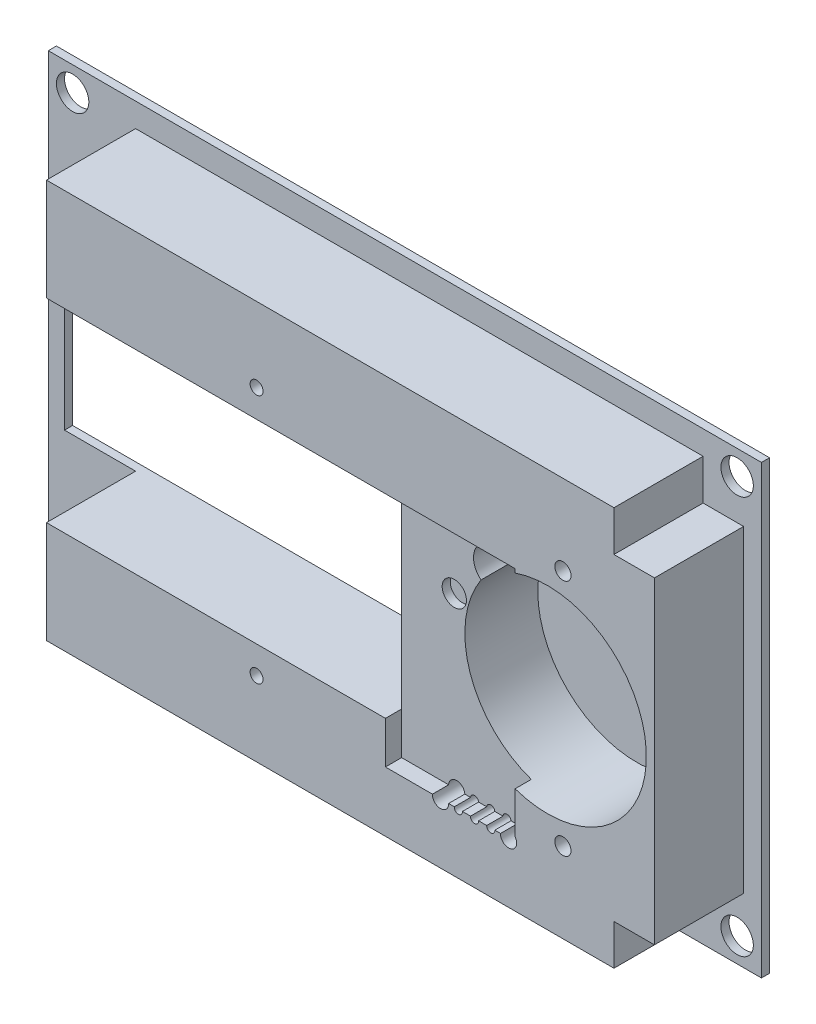
from build123d import *

# Parameters (mm, degrees)
SKETCH_1_W          = 75.027591161
SKETCH_1_H          = 49.216029974
EXTRUDE_1_DEPTH     = 11
CUT_EXTRUDE_START   = -11
SKETCH_2_R          = 1
SKETCH_2_R_2        = 1.5
SKETCH_2_R_3        = 0.8
CUT_EXTRUDE_1_DEPTH = 3
SKETCH_2_4_R        = 12.2
SKETCH_2_4_W        = 5
SKETCH_2_4_H        = 5
SKETCH_2_4_W_2      = 41.827591161
SKETCH_2_4_H_2      = 24
CUT_EXTRUDE_3_DEPTH = 80.722605558
SKETCH_4_W          = 88
SKETCH_4_H          = 55.1
SKETCH_4_R          = 2
SKETCH_4_W_2        = 50.6
SKETCH_4_H_2        = 24
EXTRUDE_2_DEPTH     = 1
SKETCH_5_R          = 2.5
CUT_EXTRUDE_4_DEPTH = 91.910079199
SKETCH_7_W          = 9.2
SKETCH_7_H          = 5
CUT_EXTRUDE_6_DEPTH = 2
SKETCH_8_R          = 1
SKETCH_8_R_2        = 0.5
CUT_EXTRUDE_7_DEPTH = 91.910079199
SKETCH_9_W          = 16
SKETCH_9_H          = 29.2
CUT_EXTRUDE_8_DEPTH = 2


with BuildPart() as part:
    # 草图1 → 凸台-拉伸1 (new body)
    with BuildSketch(Plane.XY):
        with Locations((-37.513795581, 0)):
            Rectangle(SKETCH_1_W, SKETCH_1_H)
    extrude(amount=EXTRUDE_1_DEPTH)

    # 草图2 → 切除-拉伸1 (cut)
    with BuildSketch(Plane(origin=(0, 0, 0), x_dir=(-1, 0, 0), z_dir=(0, 0, -1)).offset(CUT_EXTRUDE_START)):
        with Locations(Location((11.3, 14.7, 0), (0, 0, 180))):
            Circle(SKETCH_2_R)
        with Locations(Location((11.3, -14.7, 0), (0, 0, 180))):
            Circle(SKETCH_2_R)
        with Locations(Location((26.7, 3.6, 0), (0, 0, 180))):
            Circle(SKETCH_2_R_2)
        with Locations(Location((49.1, 15.4, 0), (0, 0, 180))):
            Circle(SKETCH_2_R_3)
        with Locations(Location((49.1, -15.4, 0), (0, 0, 180))):
            Circle(SKETCH_2_R_3)
    extrude(amount=CUT_EXTRUDE_1_DEPTH, mode=Mode.SUBTRACT)

    # 草图2<4> → 切除-拉伸3 (cut, through all)
    with BuildSketch(Plane(origin=(0, 0, 0), x_dir=(-1, 0, 0), z_dir=(0, 0, -1))):
        with Locations((13.2, 0)):
            Circle(SKETCH_2_4_R)
        with Locations((2.5, 22.108014987)):
            Rectangle(SKETCH_2_4_W, SKETCH_2_4_H)
        with Locations((2.5, -22.108014987)):
            Rectangle(SKETCH_2_4_W, SKETCH_2_4_H)
        with Locations((54.113795581, 0)):
            Rectangle(SKETCH_2_4_W_2, SKETCH_2_4_H_2)
    extrude(amount=-CUT_EXTRUDE_3_DEPTH, mode=Mode.SUBTRACT)

    # 草图4 → 凸台-拉伸2 (add)
    with BuildSketch(Plane(origin=(0, 0, 0), x_dir=(-1, 0, 0), z_dir=(0, 0, -1))):
        with Locations((41.8, 0)):
            Rectangle(SKETCH_4_W, SKETCH_4_H)
        with Locations((0.8, 24.55)):
            Circle(SKETCH_4_R, mode=Mode.SUBTRACT)
        with Locations((0.8, -24.55)):
            Circle(SKETCH_4_R, mode=Mode.SUBTRACT)
        with Locations((82.8, -24.55)):
            Circle(SKETCH_4_R, mode=Mode.SUBTRACT)
        with Locations((82.8, 24.55)):
            Circle(SKETCH_4_R, mode=Mode.SUBTRACT)
        with Locations((58.5, 0)):
            Rectangle(SKETCH_4_W_2, SKETCH_4_H_2, mode=Mode.SUBTRACT)
    extrude(amount=EXTRUDE_2_DEPTH)

    # 草图5 → 切除-拉伸4 (cut, through all)
    with BuildSketch(Plane.XY.offset(11)):
        with Locations((-21.82670273, 8.62670273)):
            Circle(SKETCH_5_R)
    extrude(amount=-CUT_EXTRUDE_4_DEPTH, mode=Mode.SUBTRACT)

    # 草图7 → 切除-拉伸6 (cut)
    with BuildSketch(Plane(origin=(0, 0, -1), x_dir=(-1, 0, 0), z_dir=(0, 0, -1))):
        with Locations((22.2, -17.25)):
            Rectangle(SKETCH_7_W, SKETCH_7_H)
    extrude(amount=-CUT_EXTRUDE_6_DEPTH, mode=Mode.SUBTRACT)

    # 草图8 → 切除-拉伸7 (cut, through all)
    with BuildSketch(Plane.XY.offset(11)):
        with Locations((-26.4, -17.25)):
            Circle(SKETCH_8_R)
        with Locations((-24.2, -17.25)):
            Circle(SKETCH_8_R_2)
        with Locations((-22.2, -17.25)):
            Circle(SKETCH_8_R_2)
        with Locations((-20.2, -17.25)):
            Circle(SKETCH_8_R_2)
        with Locations((-18, -17.25)):
            Circle(SKETCH_8_R)
    extrude(amount=-CUT_EXTRUDE_7_DEPTH, mode=Mode.SUBTRACT)

    # 草图9 → 切除-拉伸8 (cut)
    with BuildSketch(Plane.XY.offset(11)):
        with Locations((-25.2, -2.6)):
            Rectangle(SKETCH_9_W, SKETCH_9_H)
    extrude(amount=-CUT_EXTRUDE_8_DEPTH, mode=Mode.SUBTRACT)


solid = part.part
